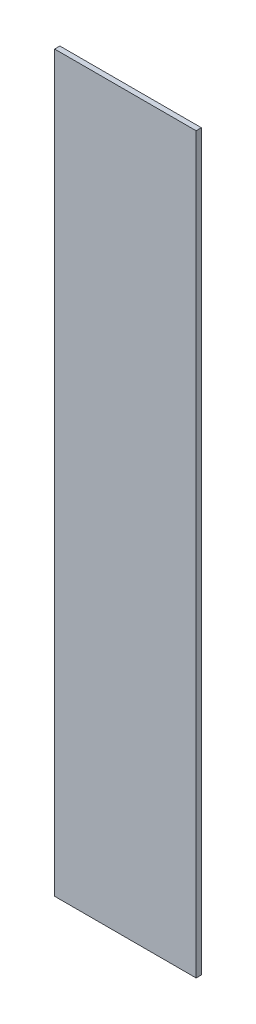
from build123d import *

# Parameters (mm, degrees)
SKETCH1_W           = 342.9
SKETCH1_H           = 1778
BOSS_EXTRUDE1_DEPTH = 12.7


with BuildPart() as part:
    # Sketch1 → Boss-Extrude1 (new body)
    with BuildSketch(Plane.XY):
        Rectangle(SKETCH1_W, SKETCH1_H)
    extrude(amount=BOSS_EXTRUDE1_DEPTH)


solid = part.part
